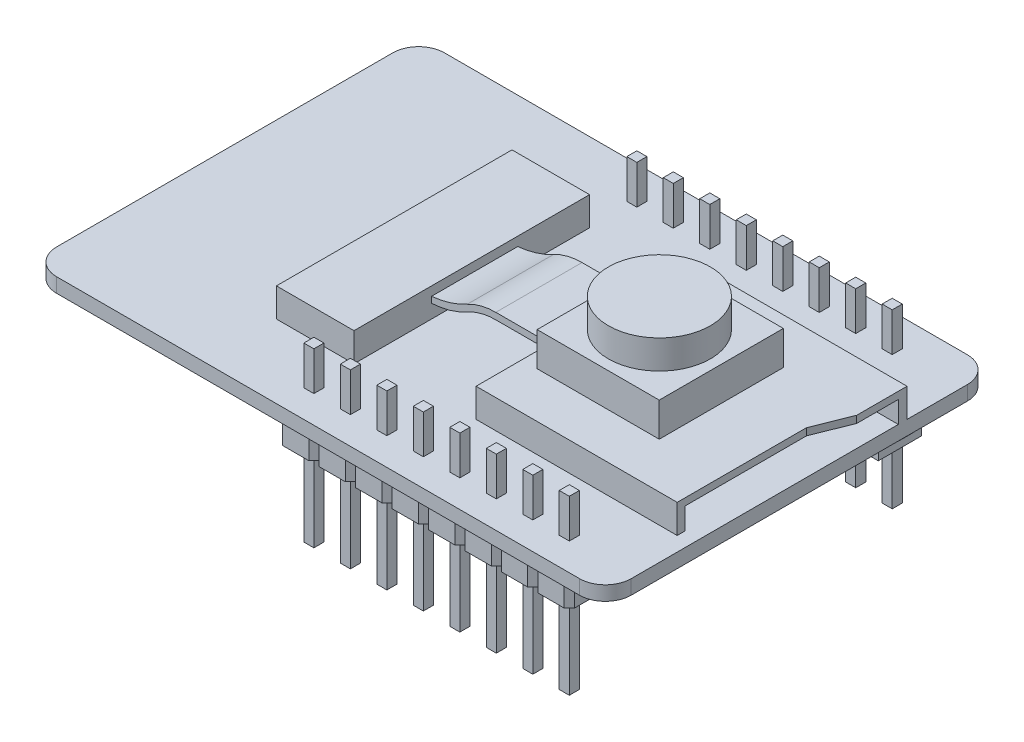
from build123d import *

# Parameters (mm, degrees)
SKETCH_1_W         = 40
SKETCH_1_H         = 27
EXTRUDE_1_DEPTH    = 1
FILLET_1_R         = 1.8
SKETCH_4_W         = 25.5
SKETCH_4_H         = 18
ESP32_DEPTH        = 1
ESP32_2_DEPTH      = 2.4
SKETCH_6_W         = 2.8
SKETCH_6_H         = 2.4
EXTRUDE_1458_DEPTH = 0.5
SKETCH_7_R         = 0.10095191
EXTRUDE_1594_DEPTH = 0.5
SKETCH_8_R         = 1
SKETCH_8_R_2       = 0.774591052
EXTRUDE_1767_DEPTH = 0.5
EXTRUDE_2203_DEPTH = 0.1
SKETCH_10_W        = 4
SKETCH_10_H        = 5
FLASH_DEPTH        = 1.5
EXTRUDE_4368_DEPTH = 2.3
SKETCH_3_W         = 0.7
SKETCH_3_H         = 0.7
EXTRUDE_5629_DEPTH = 6
SKETCH_11_W        = 3.5
SKETCH_11_H        = 6.5
AMS1117_DEPTH      = 1.5
SKETCH_12_W        = 4
SKETCH_12_H        = 3
EXTRUDE_6088_DEPTH = 1.5
SKETCH_13_R        = 0.870557087
EXTRUDE_6278_DEPTH = 0.5
SKETCH_14_W        = 1.736410673
SKETCH_14_H        = 3.378003939
SKETCH_14_W_2      = 2.095155041
SKETCH_14_H_2      = 1
SKETCH_14_W_3      = 1.766738633
SKETCH_14_H_3      = 0.57826537
SKETCH_14_W_4      = 0.5
SKETCH_14_W_5      = 0.511797239
EXTRUDE_6951_DEPTH = 0.5
SD_DEPTH           = 2
SKETCH_16_W        = 13.843040366
SKETCH_16_H        = 1.506755829
SD_2_DEPTH         = 14
SKETCH_17_W        = 8.5
SKETCH_17_H        = 8.64
OV2640_DEPTH       = 2.36
SKETCH_18_R        = 3.55
OV2640_2_DEPTH     = 2
SKETCH_19_W        = 5.4
SKETCH_19_H        = 16.4
EXTRUDE_18_DEPTH   = 2
EXTRUDE_19_DEPTH   = 3


with BuildPart() as part:
    # 草图1 → 凸台-拉伸1 (new body)
    with BuildSketch(Plane(origin=(0, 0, 0), x_dir=(1, 0, 0), z_dir=(0, 1, 0))):
        Rectangle(SKETCH_1_W, SKETCH_1_H)
    extrude(amount=EXTRUDE_1_DEPTH)

    # 圆角1
    fillet_1_edges = [part.edges().sort_by_distance(p)[0] for p in [
        (-20, 0.5, -13.5),
        (20, 0.5, -13.5),
        (20, 0.5, 13.5),
        (-20, 0.5, 13.5),
    ]]
    fillet(fillet_1_edges, radius=FILLET_1_R)

    # 草图4 → esp32 (add)
    with BuildSketch(Plane.XZ):
        with Locations((-7.25, 0)):
            Rectangle(SKETCH_4_W, SKETCH_4_H)
    extrude(amount=ESP32_DEPTH)

    # 草图5 → esp32 2 (add)
    with BuildSketch(Plane.XZ.offset(1)):
        Polygon((-12.65, 2.15), (-9.41, 2.15), (-9.41, 7.85), (4.35, 7.85), (4.35, -7.85), (-9.079809859, -7.85), (-12.65, -7.85), align=None)
    extrude(amount=ESP32_2_DEPTH)

    # 草图6 → Extrude 1458 (add)
    with BuildSketch(Plane.XZ.offset(1)):
        with Locations((-12.6, 6.8)):
            Rectangle(SKETCH_6_W, SKETCH_6_H)
    extrude(amount=EXTRUDE_1458_DEPTH)

    # 草图7 → Extrude 1594 (add)
    with BuildSketch(Plane.XZ.offset(1.5)):
        with Locations(Location((-12.634547218, 6.84503639, 0), (0, 0, 270))):
            Circle(SKETCH_7_R)
    extrude(amount=EXTRUDE_1594_DEPTH)

    # 草图8 → Extrude 1767 (add)
    with BuildSketch(Plane.XZ.offset(1.5)):
        with Locations(Location((-12.634547218, 6.84503639, 0), (0, 0, 270))):
            Circle(SKETCH_8_R)
        with Locations(Location((-12.634547218, 6.84503639, 0), (0, 0, 270))):
            Circle(SKETCH_8_R_2, mode=Mode.SUBTRACT)
    extrude(amount=EXTRUDE_1767_DEPTH)

    # 草图9 → Extrude 2203 (add)
    with BuildSketch(Plane.XZ.offset(1)):
        Polygon((-15.544769203, -7.993846837), (-18.544769203, -7.993846837), (-18.544769203, -4.993846837), (-15.544769203, -4.993846837), (-15.544769203, -1.993846837), (-18.544769203, -1.993846837), (-18.544769203, 1.006153163), (-15.544769203, 1.006153163), (-15.544769203, 4.006153163), (-18.544769203, 4.006153163), (-18.544769203, 7.006153163), (-15.544769203, 7.006153163), (-15.544769203, 8.340463502), (-19.270898352, 8.340463502), (-19.270898352, 3.401176026), (-16.021367117, 3.401176026), (-16.021367117, 1.581438534), (-19.270898352, 1.581438534), (-19.270898352, -2.751269779), (-16.021367117, -2.751269779), (-16.021367117, -4.397698938), (-19.270898352, -4.397698938), (-19.270898352, -8.600426001), (-13.898340044, -8.600426001), (-13.898340044, -7.993846837), align=None)
    extrude(amount=EXTRUDE_2203_DEPTH)

    # 草图10 → FLASH (add)
    with BuildSketch(Plane.XZ):
        with Locations((14.5, 6.9)):
            Rectangle(SKETCH_10_W, SKETCH_10_H)
    extrude(amount=FLASH_DEPTH)

    # 草图2 → Extrude 4368 (add)
    with BuildSketch(Plane.XZ):
        Polygon((-3.820754679, 12.156555373), (-3.820754679, 10.323662154), (-3.467201288, 9.970108763), (-1.634308069, 9.970108763), (-1.280754679, 10.323662154), (-0.927201288, 9.970108763), (0.905691931, 9.970108763), (1.259245321, 10.323662154), (1.612798712, 9.970108763), (3.445691931, 9.970108763), (3.799245321, 10.323662154), (4.152798712, 9.970108763), (5.985691931, 9.970108763), (6.339245321, 10.323662154), (6.692798712, 9.970108763), (8.525691931, 9.970108763), (8.879245321, 10.323662154), (9.232798712, 9.970108763), (11.065691931, 9.970108763), (11.419245321, 10.323662154), (11.772798712, 9.970108763), (13.605691931, 9.970108763), (13.959245321, 10.323662154), (14.312798712, 9.970108763), (16.145691931, 9.970108763), (16.499245321, 10.323662154), (16.499245321, 12.156555373), (16.145691931, 12.510108763), (14.312798712, 12.510108763), (13.959245321, 12.156555373), (13.605691931, 12.510108763), (11.772798712, 12.510108763), (11.419245321, 12.156555373), (11.065691931, 12.510108763), (9.232798712, 12.510108763), (8.879245321, 12.156555373), (8.525691931, 12.510108763), (6.692798712, 12.510108763), (6.339245321, 12.156555373), (5.985691931, 12.510108763), (4.152798712, 12.510108763), (3.799245321, 12.156555373), (3.445691931, 12.510108763), (1.612798712, 12.510108763), (1.259245321, 12.156555373), (0.905691931, 12.510108763), (-0.927201288, 12.510108763), (-1.280754679, 12.156555373), (-1.634308069, 12.510108763), (-3.467201288, 12.510108763), align=None)
        Polygon((14.312798712, -12.510108763), (13.959245321, -12.156555373), (13.605691931, -12.510108763), (11.772798712, -12.510108763), (11.419245321, -12.156555373), (11.065691931, -12.510108763), (9.232798712, -12.510108763), (8.879245321, -12.156555373), (8.525691931, -12.510108763), (6.692798712, -12.510108763), (6.339245321, -12.156555373), (5.985691931, -12.510108763), (4.152798712, -12.510108763), (3.799245321, -12.156555373), (3.445691931, -12.510108763), (1.612798712, -12.510108763), (1.259245321, -12.156555373), (0.905691931, -12.510108763), (-0.927201288, -12.510108763), (-1.280754679, -12.156555373), (-1.634308069, -12.510108763), (-3.467201288, -12.510108763), (-3.820754679, -12.156555373), (-3.820754679, -10.323662154), (-3.467201288, -9.970108763), (-1.634308069, -9.970108763), (-1.280754679, -10.323662154), (-0.927201288, -9.970108763), (0.905691931, -9.970108763), (1.259245321, -10.323662154), (1.612798712, -9.970108763), (3.445691931, -9.970108763), (3.799245321, -10.323662154), (4.152798712, -9.970108763), (5.985691931, -9.970108763), (6.339245321, -10.323662154), (6.692798712, -9.970108763), (8.525691931, -9.970108763), (8.879245321, -10.323662154), (9.232798712, -9.970108763), (11.065691931, -9.970108763), (11.419245321, -10.323662154), (11.772798712, -9.970108763), (13.605691931, -9.970108763), (13.959245321, -10.323662154), (14.312798712, -9.970108763), (16.145691931, -9.970108763), (16.499245321, -10.323662154), (16.499245321, -12.156555373), (16.145691931, -12.510108763), align=None)
    extrude(amount=EXTRUDE_4368_DEPTH)

    # 草图3 → Extrude 5629 (add, symmetric)
    with BuildSketch(Plane.XZ.offset(2.3)):
        with Locations((-2.550754679, 11.240108763)):
            Rectangle(SKETCH_3_W, SKETCH_3_H)
        with Locations((-0.010754679, 11.240108763)):
            Rectangle(SKETCH_3_W, SKETCH_3_H)
        with Locations((2.529245321, 11.240108763)):
            Rectangle(SKETCH_3_W, SKETCH_3_H)
        with Locations((5.069245321, 11.240108763)):
            Rectangle(SKETCH_3_W, SKETCH_3_H)
        with Locations((7.609245321, 11.240108763)):
            Rectangle(SKETCH_3_W, SKETCH_3_H)
        with Locations((10.149245321, 11.240108763)):
            Rectangle(SKETCH_3_W, SKETCH_3_H)
        with Locations((12.689245321, 11.240108763)):
            Rectangle(SKETCH_3_W, SKETCH_3_H)
        with Locations((15.229245321, 11.240108763)):
            Rectangle(SKETCH_3_W, SKETCH_3_H)
        with Locations((-2.550754679, -11.240108763)):
            Rectangle(SKETCH_3_W, SKETCH_3_H)
        with Locations((15.229245321, -11.240108763)):
            Rectangle(SKETCH_3_W, SKETCH_3_H)
        with Locations((12.689245321, -11.240108763)):
            Rectangle(SKETCH_3_W, SKETCH_3_H)
        with Locations((10.149245321, -11.240108763)):
            Rectangle(SKETCH_3_W, SKETCH_3_H)
        with Locations((7.609245321, -11.240108763)):
            Rectangle(SKETCH_3_W, SKETCH_3_H)
        with Locations((5.069245321, -11.240108763)):
            Rectangle(SKETCH_3_W, SKETCH_3_H)
        with Locations((2.529245321, -11.240108763)):
            Rectangle(SKETCH_3_W, SKETCH_3_H)
        with Locations((-0.010754679, -11.240108763)):
            Rectangle(SKETCH_3_W, SKETCH_3_H)
    extrude(amount=EXTRUDE_5629_DEPTH, both=True)

    # 草图11 → AMS1117 (add)
    with BuildSketch(Plane.XZ):
        with Locations((15.25, -1.25)):
            Rectangle(SKETCH_11_W, SKETCH_11_H)
    extrude(amount=AMS1117_DEPTH)

    # 草图12 → Extrude 6088 (add)
    with BuildSketch(Plane.XZ):
        with Locations((17, -8)):
            Rectangle(SKETCH_12_W, SKETCH_12_H)
    extrude(amount=EXTRUDE_6088_DEPTH)

    # 草图13 → Extrude 6278 (add)
    with BuildSketch(Plane.XZ.offset(1.5)):
        with Locations(Location((17, -8, 0), (0, 0, 270))):
            Circle(SKETCH_13_R)
    extrude(amount=EXTRUDE_6278_DEPTH)

    # 草图14 → Extrude 6951 (add)
    with BuildSketch(Plane.XZ):
        with Locations((17.868205337, -1.184137832)):
            Rectangle(SKETCH_14_W, SKETCH_14_H)
        with Locations((12.45242248, 0.908837023)):
            Rectangle(SKETCH_14_W_2, SKETCH_14_H_2)
        with Locations((12.456177996, -1.160349072)):
            Rectangle(SKETCH_14_W_2, SKETCH_14_H_2)
        with Locations((12.456177996, -3.253759964)):
            Rectangle(SKETCH_14_W_2, SKETCH_14_H_2)
        with Locations((17.383369317, 8.762932478)):
            Rectangle(SKETCH_14_W_3, SKETCH_14_H_3)
        with Locations((17.383369317, 7.632853308)):
            Rectangle(SKETCH_14_W_3, SKETCH_14_H_3)
        with Locations((17.383369317, 6.334217924)):
            Rectangle(SKETCH_14_W_3, SKETCH_14_H_3)
        with Locations((17.383369317, 5.098390509)):
            Rectangle(SKETCH_14_W_3, SKETCH_14_H_3)
        with Locations((11.616630684, 5.098390509)):
            Rectangle(SKETCH_14_W_3, SKETCH_14_H_3)
        with Locations((11.616630684, 6.334217924)):
            Rectangle(SKETCH_14_W_3, SKETCH_14_H_3)
        with Locations((11.616630684, 7.632853308)):
            Rectangle(SKETCH_14_W_3, SKETCH_14_H_3)
        with Locations((11.616630684, 8.762932478)):
            Rectangle(SKETCH_14_W_3, SKETCH_14_H_3)
        with Locations((14.75, -7.936837685)):
            Rectangle(SKETCH_14_W_4, SKETCH_14_H_2)
        with Locations((19.25589862, -7.936837685)):
            Rectangle(SKETCH_14_W_5, SKETCH_14_H_2)
    extrude(amount=EXTRUDE_6951_DEPTH)

    # 草图15 → SD (add)
    with BuildSketch(Plane(origin=(0, 1, 0), x_dir=(1, 0, 0), z_dir=(0, 1, 0))):
        Polygon((5, 7.5), (5, -7.5), (19, -7.5), (19, 1.5), (20, 4), (20, 7.5), align=None)
    extrude(amount=SD_DEPTH)

    # 草图16 → SD 2 (cut)
    with BuildSketch(Plane(origin=(20, 0, 0), x_dir=(0, 0, -1), z_dir=(1, 0, 0))):
        with Locations((-0.028308876, 1.753377915)):
            Rectangle(SKETCH_16_W, SKETCH_16_H)
    extrude(amount=-SD_2_DEPTH, mode=Mode.SUBTRACT)

    # 草图17 → OV2640 (add)
    with BuildSketch(Plane(origin=(0, 3, 0), x_dir=(1, 0, 0), z_dir=(0, 1, 0))):
        with Locations((10.320261797, 0)):
            Rectangle(SKETCH_17_W, SKETCH_17_H)
    extrude(amount=OV2640_DEPTH)

    # 草图18 → OV2640 2 (add)
    with BuildSketch(Plane(origin=(0, 5.36, 0), x_dir=(1, 0, 0), z_dir=(0, 1, 0))):
        with Locations(Location((10.320261797, -0.059710743, 0), (0, 0, 270))):
            Circle(SKETCH_18_R)
    extrude(amount=OV2640_2_DEPTH)

    # 草图19 → 凸台-拉伸18 (add)
    with BuildSketch(Plane(origin=(0, 1, 0), x_dir=(1, 0, 0), z_dir=(0, 1, 0))):
        with Locations((-5.3, -0.2)):
            Rectangle(SKETCH_19_W, SKETCH_19_H)
    extrude(amount=EXTRUDE_18_DEPTH)

    # 草图20 → 凸台-拉伸19 (add, symmetric)
    with BuildSketch(Plane.XY):
        with BuildLine():
            Line((6.070261797, 3.643183356), (1.874300797, 3.643183356))
            ThreePointArc((1.874300797, 3.643183356), (0.848357759, 3.514351265), (-0.113877871, 3.135855006))
            ThreePointArc((-0.113877871, 3.135855006), (-1.462957505, 2.585618042), (-2.900754679, 2.35))
            Line((-2.900754679, 2.35), (-2.900754679, 1.942947805))
            ThreePointArc((-2.900754679, 1.942947805), (-1.460720394, 2.127613864), (-0.113877871, 2.669661387))
            ThreePointArc((-0.113877871, 2.669661387), (0.846969614, 3.056362126), (1.874300797, 3.188104268))
            Line((1.874300797, 3.188104268), (6.070261797, 3.188104268))
            Line((6.070261797, 3.188104268), (6.070261797, 3.643183356))
        make_face()
    extrude(amount=EXTRUDE_19_DEPTH, both=True)


solid = part.part
